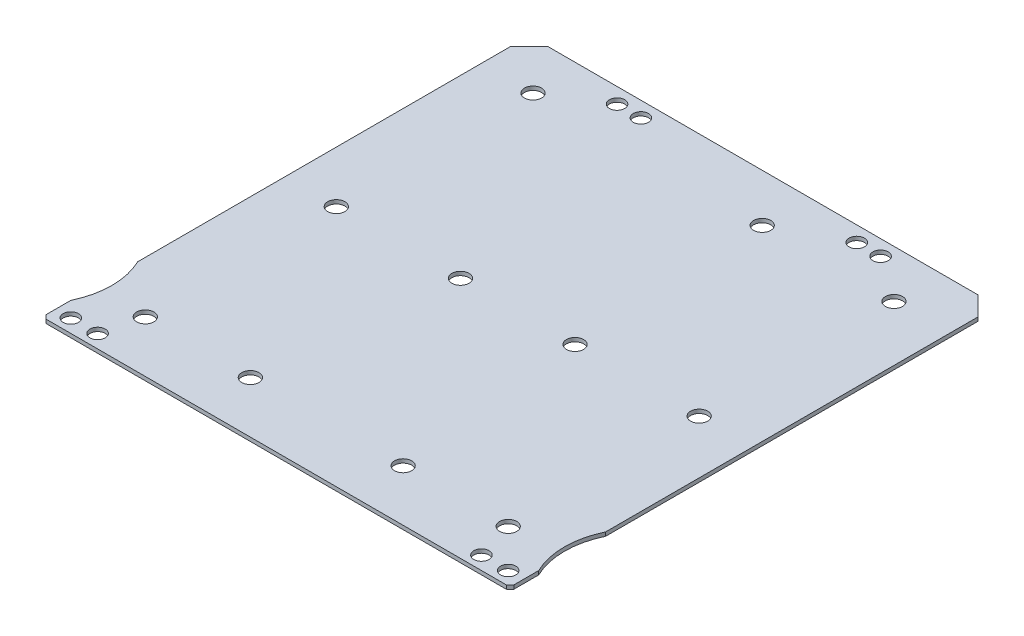
from build123d import *

# Parameters (mm, degrees)
SKETCH1_R           = 4
SKETCH1_R_2         = 4.5
BOSS_EXTRUDE1_DEPTH = 2
CHAMFER1_SIZE       = 2
CHAMFER2_SIZE       = 10


with BuildPart() as part:
    # Sketch1 → Boss-Extrude1 (new body)
    with BuildSketch(Plane(origin=(0, 0, 0), x_dir=(1, 0, 0), z_dir=(0, 1, 0))):
        with BuildLine():
            Line((0, 0), (245, 0))
            Line((245, 0), (245, 15))
            ThreePointArc((245, 15), (241, 32.5), (245, 50))
            Line((245, 50), (245, 255))
            Line((245, 255), (0, 255))
            Line((0, 255), (0, 50))
            ThreePointArc((0, 50), (4, 32.5), (0, 15))
            Line((0, 15), (0, 0))
        make_face()
        with Locations(Location((8, 7, 0), (0, 0, 270))):
            Circle(SKETCH1_R, mode=Mode.SUBTRACT)
        with Locations(Location((22, 7, 0), (0, 0, 270))):
            Circle(SKETCH1_R, mode=Mode.SUBTRACT)
        with Locations(Location((237, 7, 0), (0, 0, 270))):
            Circle(SKETCH1_R, mode=Mode.SUBTRACT)
        with Locations(Location((223, 7, 0), (0, 0, 270))):
            Circle(SKETCH1_R, mode=Mode.SUBTRACT)
        with Locations(Location((27, 27, 0), (0, 0, 270))):
            Circle(SKETCH1_R_2, mode=Mode.SUBTRACT)
        with Locations(Location((82, 27, 0), (0, 0, 270))):
            Circle(SKETCH1_R_2, mode=Mode.SUBTRACT)
        with Locations(Location((162, 27, 0), (0, 0, 270))):
            Circle(SKETCH1_R_2, mode=Mode.SUBTRACT)
        with Locations(Location((217, 27, 0), (0, 0, 270))):
            Circle(SKETCH1_R_2, mode=Mode.SUBTRACT)
        with Locations(Location((27, 127, 0), (0, 0, 270))):
            Circle(SKETCH1_R_2, mode=Mode.SUBTRACT)
        with Locations(Location((92, 127, 0), (0, 0, 270))):
            Circle(SKETCH1_R_2, mode=Mode.SUBTRACT)
        with Locations(Location((152, 127, 0), (0, 0, 270))):
            Circle(SKETCH1_R_2, mode=Mode.SUBTRACT)
        with Locations(Location((217, 127, 0), (0, 0, 270))):
            Circle(SKETCH1_R_2, mode=Mode.SUBTRACT)
        with Locations(Location((27, 230, 0), (0, 0, 270))):
            Circle(SKETCH1_R_2, mode=Mode.SUBTRACT)
        with Locations(Location((147, 230, 0), (0, 0, 270))):
            Circle(SKETCH1_R_2, mode=Mode.SUBTRACT)
        with Locations(Location((216, 230, 0), (0, 0, 270))):
            Circle(SKETCH1_R_2, mode=Mode.SUBTRACT)
        with Locations(Location((54, 247, 0), (0, 0, 270))):
            Circle(SKETCH1_R, mode=Mode.SUBTRACT)
        with Locations(Location((66.5, 247, 0), (0, 0, 270))):
            Circle(SKETCH1_R, mode=Mode.SUBTRACT)
        with Locations(Location((179.5, 247, 0), (0, 0, 270))):
            Circle(SKETCH1_R, mode=Mode.SUBTRACT)
        with Locations(Location((192, 247, 0), (0, 0, 270))):
            Circle(SKETCH1_R, mode=Mode.SUBTRACT)
    extrude(amount=BOSS_EXTRUDE1_DEPTH)

    # Chamfer1
    chamfer1_edges = [part.edges().sort_by_distance(p)[0] for p in [
        (245, 1, 0),
        (0, 1, 0),
    ]]
    chamfer(chamfer1_edges, length=CHAMFER1_SIZE)

    # Chamfer2
    chamfer2_edges = [part.edges().sort_by_distance(p)[0] for p in [
        (0, 1, -255),
        (245, 1, -255),
    ]]
    chamfer(chamfer2_edges, length=CHAMFER2_SIZE)


solid = part.part
